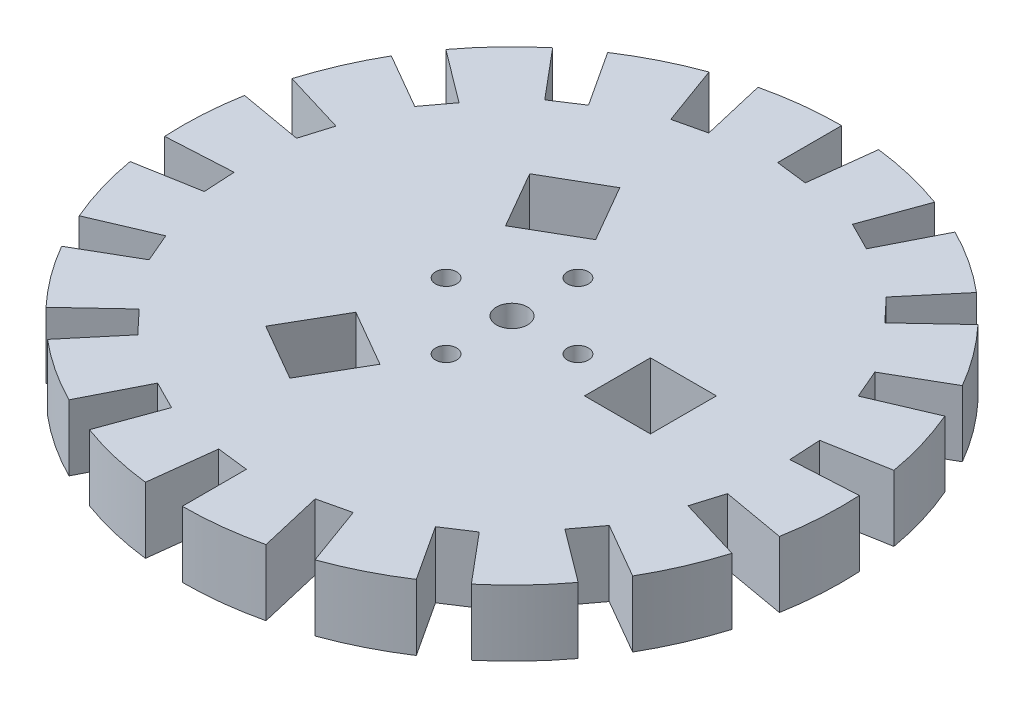
from build123d import *

# Parameters (mm, degrees)
SKETCH1_R           = 31.75
BOSS_EXTRUDE1_DEPTH = 6.35
CUT_EXTRUDE1_DEPTH  = 6.35
SKETCH3_R           = 1.500000048
SKETCH3_W           = 6.35
SKETCH3_H           = 6.35
CUT_EXTRUDE2_DEPTH  = 6.35
SKETCH4_R           = 1.016
CUT_EXTRUDE3_DEPTH  = 6.35


with BuildPart() as part:
    # Sketch1 → Boss-Extrude1 (new body)
    with BuildSketch(Plane(origin=(0, 0, 0), x_dir=(1, 0, 0), z_dir=(0, 1, 0))):
        with Locations(Location((0, 0, 0), (0, 0, 270))):
            Circle(SKETCH1_R)
    extrude(amount=BOSS_EXTRUDE1_DEPTH)

    # Sketch2 → Cut-Extrude1 (cut)
    with BuildSketch(Plane(origin=(0, 6.35, 0), x_dir=(1, 0, 0), z_dir=(0, 1, 0))):
        Polygon((3.782860755, 31.523839622), (3.026288604, 25.219071698), (0, 25.58222633), (0, 31.75), (0, 34.308222633), (4.087660755, 34.063839622), align=None)
        Polygon((14.336514482, 28.328904894), (11.469211586, 22.663123915), (8.749636716, 24.039429306), (10.859139551, 29.83524071), (11.734103222, 32.239183641), (15.491663957, 30.611476411), align=None)
        Polygon((23.160972979, 21.717086146), (18.528778383, 17.373668917), (16.443938113, 19.597122323), (20.408506608, 24.321911069), (22.052900419, 26.281623301), (25.027143854, 23.466917368), align=None)
        Polygon((29.191876315, 12.485866298), (23.353501052, 9.988693039), (22.154857887, 12.791113165), (27.49630657, 15.875), (29.711792359, 17.154111317), (31.54398084, 13.491901755), align=None)
        Polygon((31.701808541, 1.748666704), (25.361446833, 1.398933363), (25.193574829, 4.442306983), (31.267646158, 5.513329641), (33.787003641, 5.957560339), (34.256148198, 1.889563672), align=None)
        Polygon((30.388034788, -9.199447903), (24.31042783, -7.359558323), (25.193574829, -4.442306983), (31.267646158, -5.513329641), (33.787003641, -5.957560339), (32.836518516, -9.940683678), align=None)
        Polygon((25.40901556, -19.037973323), (20.327212448, -15.230378659), (22.154857887, -12.791113165), (27.49630657, -15.875), (29.711792359, -17.154111317), (27.456320086, -20.571937867), align=None)
        Polygon((17.365294059, -26.58023819), (13.892235247, -21.264190552), (16.443938113, -19.597122323), (20.408506608, -24.321911069), (22.052900419, -26.281623301), (18.764484241, -28.721912739), align=None)
        Polygon((7.227061809, -30.916534049), (5.781649447, -24.733227239), (8.749636716, -24.039429306), (10.859139551, -29.83524071), (11.734103222, -32.239183641), (7.809374662, -33.407601046), align=None)
        Polygon((-3.782860755, -31.523839622), (-3.026288604, -25.219071698), (0, -25.58222633), (0, -31.75), (0, -34.308222633), (-4.087660755, -34.063839622), align=None)
        Polygon((-14.336514482, -28.328904894), (-11.469211586, -22.663123915), (-8.749636716, -24.039429306), (-10.859139551, -29.83524071), (-11.734103222, -32.239183641), (-15.491663957, -30.611476411), align=None)
        Polygon((-23.160972979, -21.717086146), (-18.528778383, -17.373668917), (-16.443938113, -19.597122323), (-20.408506608, -24.321911069), (-22.052900419, -26.281623301), (-25.027143854, -23.466917368), align=None)
        Polygon((-29.191876315, -12.485866298), (-23.353501052, -9.988693039), (-22.154857887, -12.791113165), (-27.49630657, -15.875), (-29.711792359, -17.154111317), (-31.54398084, -13.491901755), align=None)
        Polygon((-31.701808541, -1.748666704), (-25.361446833, -1.398933363), (-25.193574829, -4.442306983), (-31.267646158, -5.513329641), (-33.787003641, -5.957560339), (-34.256148198, -1.889563672), align=None)
        Polygon((-30.388034788, 9.199447903), (-24.31042783, 7.359558323), (-25.193574829, 4.442306983), (-31.267646158, 5.513329641), (-33.787003641, 5.957560339), (-32.836518516, 9.940683678), align=None)
        Polygon((-25.40901556, 19.037973323), (-20.327212448, 15.230378659), (-22.154857887, 12.791113165), (-27.49630657, 15.875), (-29.711792359, 17.154111317), (-27.456320086, 20.571937867), align=None)
        Polygon((-17.365294059, 26.58023819), (-13.892235247, 21.264190552), (-16.443938113, 19.597122323), (-20.408506608, 24.321911069), (-22.052900419, 26.281623301), (-18.764484241, 28.721912739), align=None)
        Polygon((-7.227061809, 30.916534049), (-5.781649447, 24.733227239), (-8.749636716, 24.039429306), (-10.859139551, 29.83524071), (-11.734103222, 32.239183641), (-7.809374662, 33.407601046), align=None)
    extrude(amount=-CUT_EXTRUDE1_DEPTH, mode=Mode.SUBTRACT)

    # Sketch3 → Cut-Extrude2 (cut)
    with BuildSketch(Plane(origin=(0, 6.35, 0), x_dir=(1, 0, 0), z_dir=(0, 1, 0))):
        with Locations(Location((0, 0, 0), (0, 0, 270))):
            Circle(SKETCH3_R)
        Polygon((-2.330369343, -10.386318102), (-5.505369343, -15.885579416), (-11.004630657, -12.710579416), (-7.829630657, -7.211318102), align=None)
        Polygon((-7.829630657, 7.211318102), (-11.004630657, 12.710579416), (-5.505369343, 15.885579416), (-2.330369343, 10.386318102), align=None)
        with Locations((13.335, 0)):
            Rectangle(SKETCH3_W, SKETCH3_H)
    extrude(amount=-CUT_EXTRUDE2_DEPTH, mode=Mode.SUBTRACT)

    # Sketch4 → Cut-Extrude3 (cut)
    with BuildSketch(Plane(origin=(0, 6.35, 0), x_dir=(1, 0, 0), z_dir=(0, 1, 0))):
        with Locations(Location((6.35, 0, 0), (0, 0, 270))):
            Circle(SKETCH4_R)
        with Locations(Location((0, -6.35, 0), (0, 0, 270))):
            Circle(SKETCH4_R)
        with Locations(Location((-6.35, 0, 0), (0, 0, 270))):
            Circle(SKETCH4_R)
        with Locations(Location((0, 6.35, 0), (0, 0, 270))):
            Circle(SKETCH4_R)
    extrude(amount=-CUT_EXTRUDE3_DEPTH, mode=Mode.SUBTRACT)


solid = part.part
